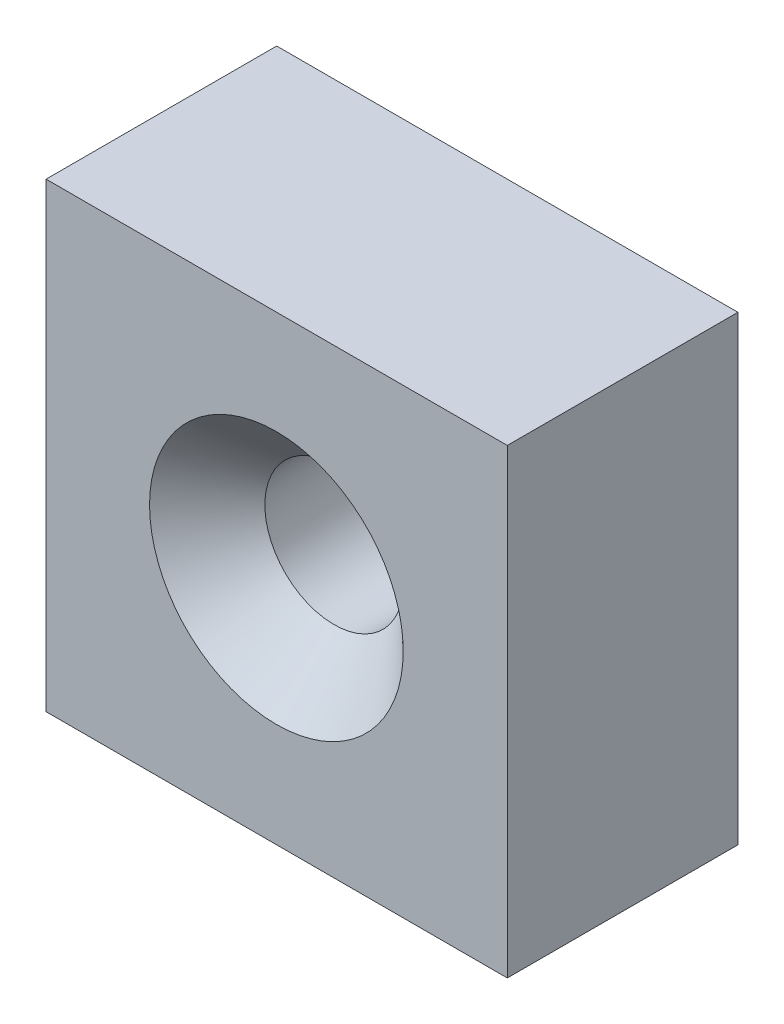
from build123d import *

# Parameters (mm, degrees)
SKETCH_1_W                          = 20
SKETCH_1_H                          = 20
BASEBOX_DEPTH                       = 10
HOLE_CS_ISO_FLATHEAD_M6_D           = 6
HOLE_CS_ISO_FLATHEAD_M6_CSINK_D     = 11
HOLE_CS_ISO_FLATHEAD_M6_CSINK_ANGLE = 90


with BuildPart() as part:
    # 草图1 → BaseBox (new body)
    with BuildSketch(Plane.XY):
        with Locations((10, 10)):
            Rectangle(SKETCH_1_W, SKETCH_1_H)
    extrude(amount=BASEBOX_DEPTH)

    # Hole_cs_iso_flathead_m6 (through all)
    with Locations(Plane.XY.offset(10)):
        with Locations((9.986487375, 10.014305599)):
            CounterSinkHole(HOLE_CS_ISO_FLATHEAD_M6_D / 2, HOLE_CS_ISO_FLATHEAD_M6_CSINK_D / 2, counter_sink_angle=HOLE_CS_ISO_FLATHEAD_M6_CSINK_ANGLE)


solid = part.part
